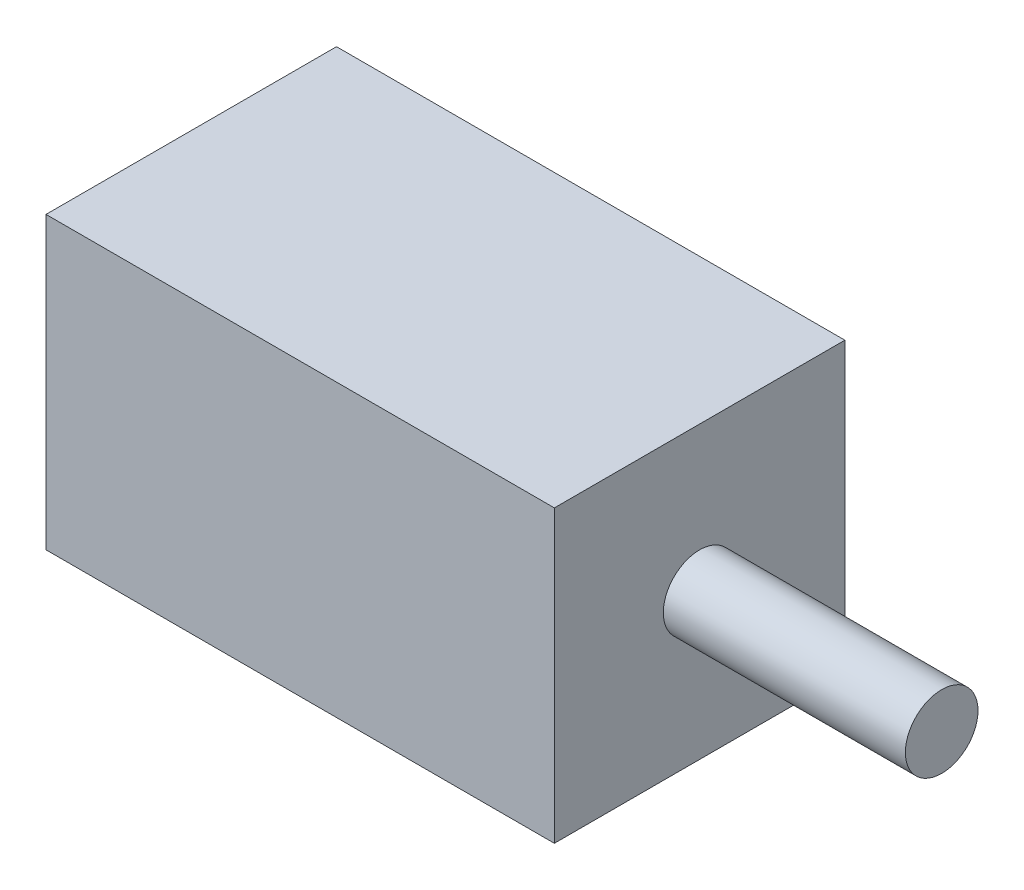
from build123d import *

# Parameters (mm, degrees)
SKETCH1_W           = 21
SKETCH1_H           = 12
BOSS_EXTRUDE1_DEPTH = 12
BOSS_EXTRUDE2_DEPTH = 10


with BuildPart() as part:
    # Sketch1 → Boss-Extrude1 (new body)
    with BuildSketch(Plane(origin=(0, 0, 0), x_dir=(1, 0, 0), z_dir=(0, 1, 0))):
        with Locations((-4.056818182, -0.213068182)):
            Rectangle(SKETCH1_W, SKETCH1_H)
    extrude(amount=BOSS_EXTRUDE1_DEPTH)

    # Sketch2 → Boss-Extrude2 (add)
    with BuildSketch(Plane(origin=(6.443181818, 0, 0), x_dir=(0, 0, -1), z_dir=(1, 0, 0))):
        with BuildLine():
            ThreePointArc((1.286931818, 6), (-0.213068182, 7.5), (-1.713068182, 6))
            Line((-1.713068182, 6), (1.286931818, 6))
        make_face()
        with BuildLine():
            Line((1.286931818, 6), (-1.713068182, 6))
            ThreePointArc((-1.713068182, 6), (-0.213068182, 4.5), (1.286931818, 6))
        make_face()
    extrude(amount=BOSS_EXTRUDE2_DEPTH)


solid = part.part
